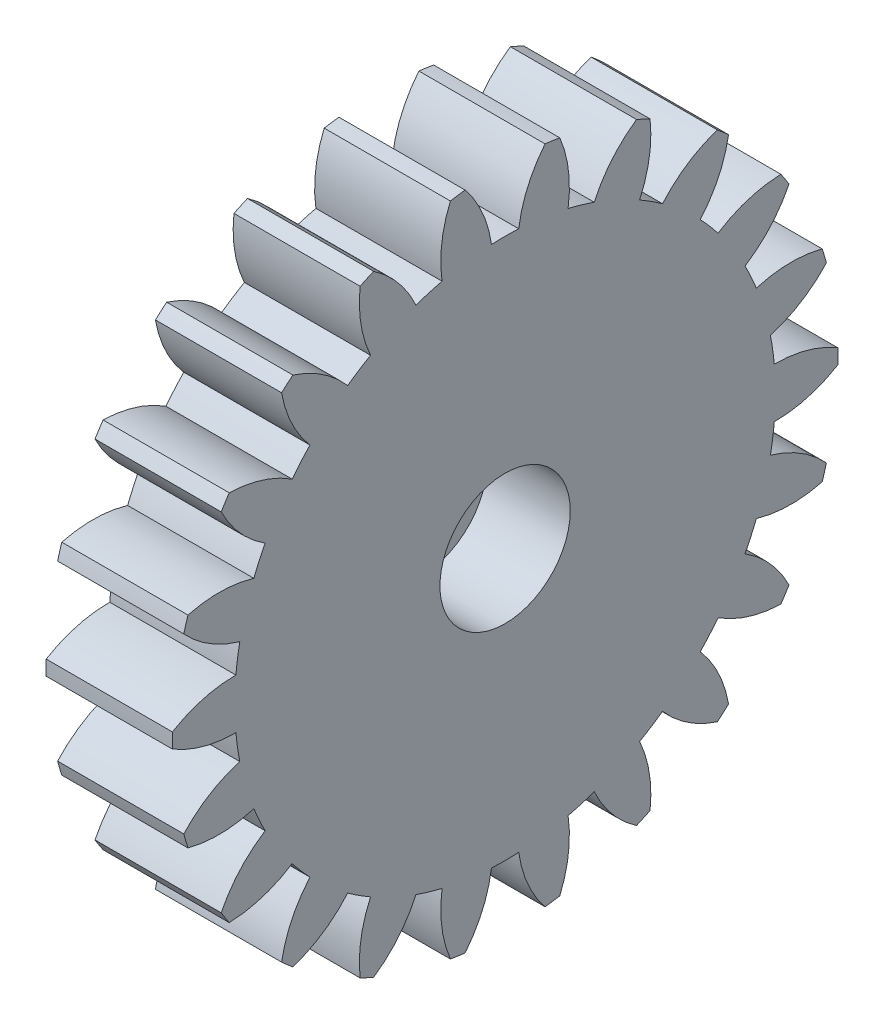
from build123d import *
from build123d.topology import SkipClean

# Parameters (mm, degrees)
BASPROSKE_W         = 4.55
BASPROSKE_H         = 12
TOOTHCUT_DEPTH      = 18.569931702
TEETHCUTS_COUNT     = 22
TEETHCUTS_ANGLE     = 343.636363636
BORSKE_R            = 1.35
BORE_DEPTH          = 50.0000508
SKETCH1_R           = 4
SKETCH1_R_2         = 1.35
BOSS_EXTRUDE1_DEPTH = 4
SKETCH1_4_R         = 6
SKETCH1_4_R_2       = 4
BOSS_EXTRUDE2_DEPTH = 1
SKETCH2_2_R         = 2.35
CUT_EXTRUDE1_DEPTH  = 3


with BuildPart() as part:
    # BasProSke → Base-Revolve (revolve)
    with BuildSketch(Plane(origin=(0, 0, 0), x_dir=(1, 0, 0), z_dir=(0, 1, 0))):
        with Locations((2.275, 6)):
            Rectangle(BASPROSKE_W, BASPROSKE_H)
    revolve(axis=Axis((-10, 0, 0), (1, 0, 0)))

    # TooCutSke → ToothCut (cut, through all)
    with BuildSketch(Plane(origin=(0, 0, 0), x_dir=(0, 0, -1), z_dir=(1, 0, 0))):
        with BuildLine():
            ThreePointArc((0.491001901, 9.736627657), (0, 9.749), (-0.491001901, 9.736627657))
            ThreePointArc((-0.491001901, 9.736627657), (-0.822824844, 10.904005344), (-1.46093845, 11.936327074))
            ThreePointArc((-1.46093845, 11.936327074), (0, 12.0254), (1.46093845, 11.936327074))
            ThreePointArc((1.46093845, 11.936327074), (0.822824844, 10.904005344), (0.491001901, 9.736627657))
        make_face()
    toothcut = extrude(amount=TOOTHCUT_DEPTH, mode=Mode.SUBTRACT)

    # TeethCuts: ToothCut ×22 about axis
    teethcuts_axis = Axis((-10, 0, 0), (1, 0, 0))
    for i in range(1, TEETHCUTS_COUNT):
        add(toothcut.rotate(teethcuts_axis, i * TEETHCUTS_ANGLE / (TEETHCUTS_COUNT - 1)), mode=Mode.SUBTRACT)

    # BorSke → Bore (cut, symmetric)
    with BuildSketch(Plane(origin=(0, 0, 0), x_dir=(0, 0, -1), z_dir=(1, 0, 0))):
        Circle(BORSKE_R)
    extrude(amount=BORE_DEPTH, both=True, mode=Mode.SUBTRACT)

    # Sketch1 → Boss-Extrude1 (add)
    with SkipClean():  # the faces are left unmerged after this step: merging them gives an invalid solid
        with BuildSketch(Plane.ZY):
            Circle(SKETCH1_R)
            Circle(SKETCH1_R_2, mode=Mode.SUBTRACT)
        extrude(amount=BOSS_EXTRUDE1_DEPTH)

    # Sketch1<4> → Boss-Extrude2 (add)
    with SkipClean():  # the faces are left unmerged after this step: merging them gives an invalid solid
        with BuildSketch(Plane.ZY):
            Circle(SKETCH1_4_R)
            Circle(SKETCH1_4_R_2, mode=Mode.SUBTRACT)
        extrude(amount=BOSS_EXTRUDE2_DEPTH)

    # Sketch2<2> → Cut-Extrude1 (cut)
    with SkipClean():  # the faces are left unmerged after this step: merging them gives an invalid solid
        with BuildSketch(Plane(origin=(4.55, 0, 0), x_dir=(0, 0, -1), z_dir=(1, 0, 0))):
            Circle(SKETCH2_2_R)
        extrude(amount=-CUT_EXTRUDE1_DEPTH, mode=Mode.SUBTRACT)


solid = part.part
